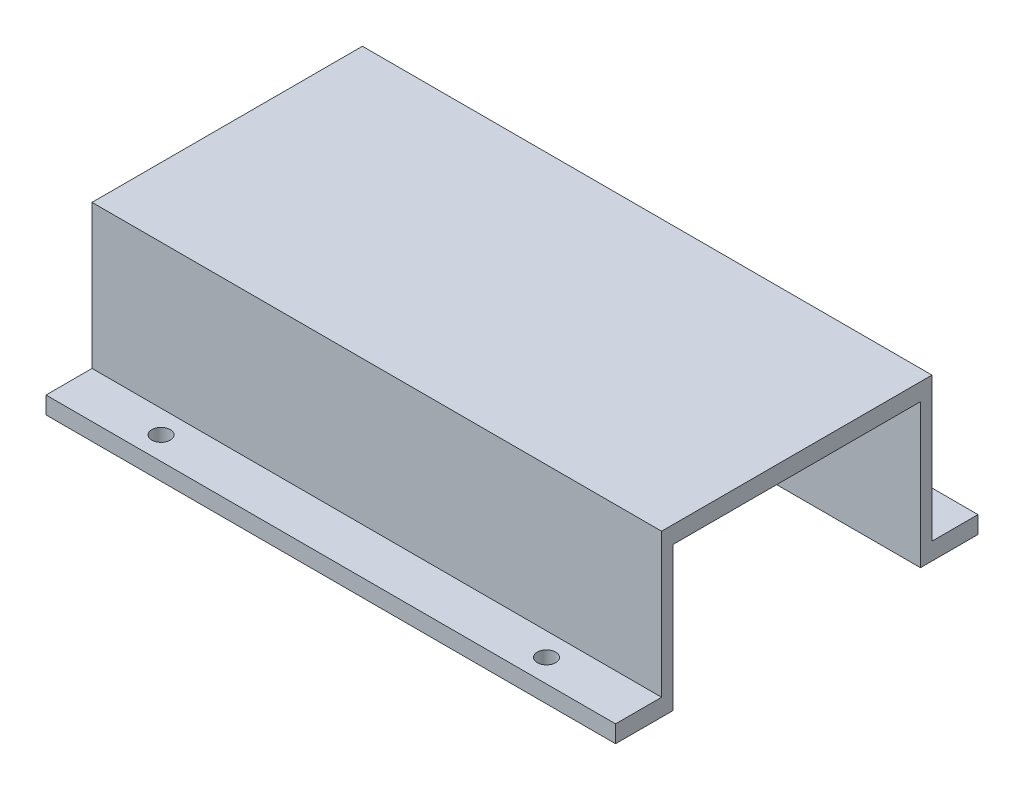
from build123d import *

# Parameters (mm, degrees)
SKETCH1_W           = 99
SKETCH1_H           = 47
BOSS_EXTRUDE1_DEPTH = 3
SKETCH1_5_W         = 99
SKETCH1_5_H         = 2
BOSS_EXTRUDE2_DEPTH = 25
SKETCH3_W           = 99
SKETCH3_H           = 8
SKETCH3_R           = 1.6
BOSS_EXTRUDE3_DEPTH = 3


with BuildPart() as part:
    # Sketch1 → Boss-Extrude1 (new body)
    with BuildSketch(Plane(origin=(0, 0, 0), x_dir=(1, 0, 0), z_dir=(0, 1, 0))):
        Rectangle(SKETCH1_W, SKETCH1_H)
    extrude(amount=BOSS_EXTRUDE1_DEPTH)

    # Sketch1<5> → Boss-Extrude2 (add)
    with BuildSketch(Plane(origin=(0, 0, 0), x_dir=(1, 0, 0), z_dir=(0, 1, 0))):
        with Locations((0, 22.5)):
            Rectangle(SKETCH1_5_W, SKETCH1_5_H)
        with Locations((0, -22.5)):
            Rectangle(SKETCH1_5_W, SKETCH1_5_H)
    extrude(amount=-BOSS_EXTRUDE2_DEPTH)

    # Sketch3 → Boss-Extrude3 (add)
    # profile 1 of 2: a face of its own
    with BuildSketch(Plane.XZ.offset(25)):
        with Locations((0, 27.5)):
            Rectangle(SKETCH3_W, SKETCH3_H)
        with Locations((-33.5, 27.5)):
            Circle(SKETCH3_R, mode=Mode.SUBTRACT)
        with Locations((33.5, 27.5)):
            Circle(SKETCH3_R, mode=Mode.SUBTRACT)
    # profile 2 of 2: a face of its own
    with BuildSketch(Plane.XZ.offset(25)):
        with Locations((0, -27.5)):
            Rectangle(SKETCH3_W, SKETCH3_H)
        with Locations((33.5, -27.5)):
            Circle(SKETCH3_R, mode=Mode.SUBTRACT)
        with Locations((-33.5, -27.5)):
            Circle(SKETCH3_R, mode=Mode.SUBTRACT)
    extrude(amount=-BOSS_EXTRUDE3_DEPTH)


solid = part.part
